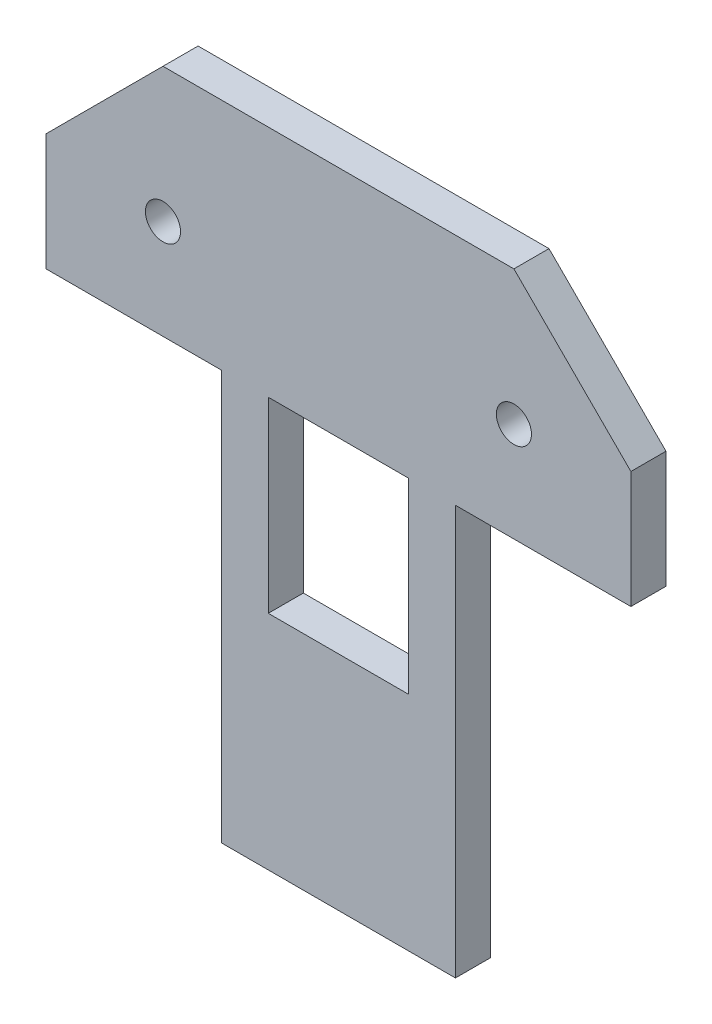
from build123d import *

# Parameters (mm, degrees)
CROQUIS1_R              = 1.5
CROQUIS1_W              = 12
CROQUIS1_H              = 16
SALIENTE_EXTRUIR1_DEPTH = 3


with BuildPart() as part:
    # Croquis1 → Saliente-Extruir1 (new body)
    with BuildSketch(Plane.XY):
        Polygon((-25, 0), (-15, 10), (15, 10), (25, 0), (25, -10), (10, -10), (10, -45), (-10, -45), (-10, -10), (-25, -10), align=None)
        with Locations((-15, -1.5)):
            Circle(CROQUIS1_R, mode=Mode.SUBTRACT)
        with Locations((15, -1.5)):
            Circle(CROQUIS1_R, mode=Mode.SUBTRACT)
        with Locations((0, -18)):
            Rectangle(CROQUIS1_W, CROQUIS1_H, mode=Mode.SUBTRACT)
    extrude(amount=SALIENTE_EXTRUIR1_DEPTH)


solid = part.part
